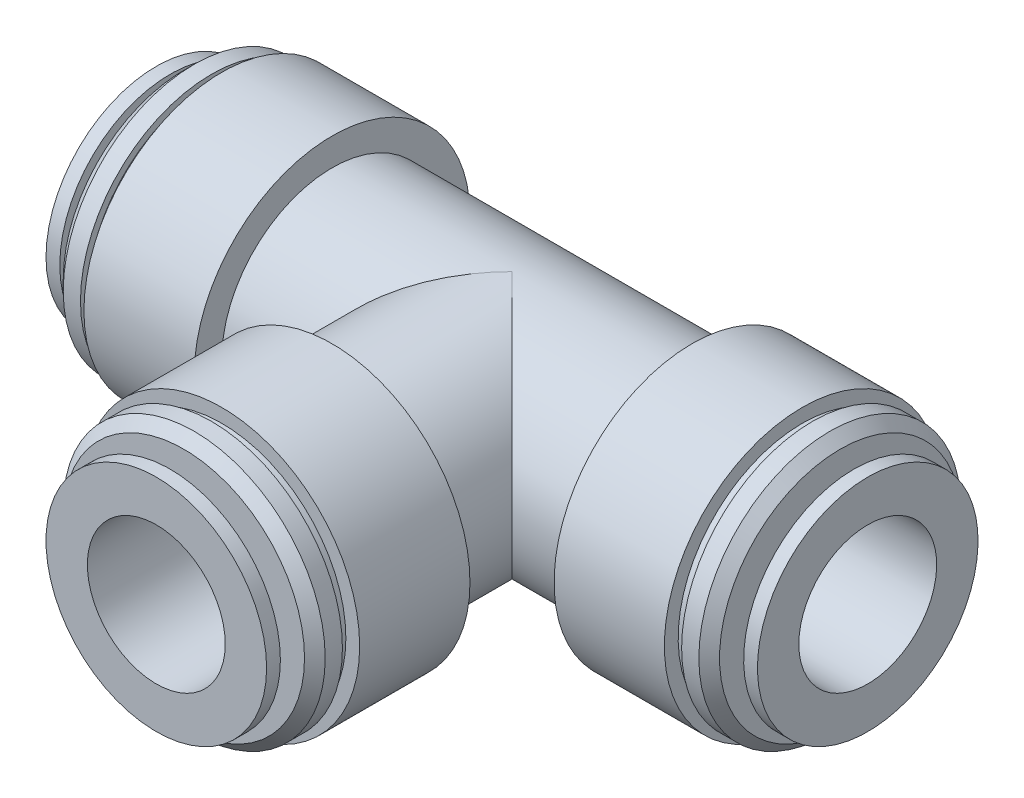
from build123d import *
from build123d.topology import SkipClean

# Parameters (mm, degrees)
SKETCH_2_R          = 8
SKETCH_2_R_2        = 4
EXTRUDE_1_DEPTH     = 26.1
SKETCH_4_R          = 8
EXTRUDE_2_DEPTH     = 13.05
SKETCH_6_R          = 5
CUT_EXTRUDE_1_DEPTH = 63.05
SKETCH_7_R          = 5
CUT_EXTRUDE_2_DEPTH = 25


with BuildPart() as part:
    # Эскиз1 → Повернуть1 (revolve)
    with BuildSketch(Plane.XY, mode=Mode.PRIVATE) as revolve_1_sk:
        Polygon((-16.75, -8), (-16.75, -6), (-15.75, -6), (-15.75, -8.75), (-15, -9.5), (-13.75, -9.5), (-13.75, -9), (-13, -9), (-13, -10), (-5, -10), (-5, -4), (-17.75, -4), (-17.75, -8), align=None)
    revolve(revolve_1_sk.sketch.rotate(Axis((-21.049489232, 0, 0), (1, 0, 0)), 270), axis=Axis((-21.049489232, 0, 0), (1, 0, 0)))

    # Эскиз2 → Бобышка-Вытянуть1 (add)
    with BuildSketch(Plane(origin=(-5, 0, 0), x_dir=(0, 0, -1), z_dir=(1, 0, 0))):
        with Locations(Location((0, 0, 0), (0, 0, 180))):
            Circle(SKETCH_2_R)
        with Locations(Location((0, 0, 0), (0, 0, 180))):
            Circle(SKETCH_2_R_2, mode=Mode.SUBTRACT)
    extrude(amount=EXTRUDE_1_DEPTH)

    # Эскиз3 → Повернуть2 (revolve)
    with SkipClean():  # the faces are left unmerged after this step: merging them gives an invalid solid
        with BuildSketch(Plane.XY):
            Polygon((32.85, 8), (32.85, 6), (31.85, 6), (31.85, 8.75), (31.1, 9.5), (29.85, 9.5), (29.85, 9), (29.1, 9), (29.1, 10), (21.1, 10), (21.1, 4), (33.85, 4), (33.85, 8), align=None)
        revolve(axis=Axis((47.149489232, 0, 0), (-1, 0, 0)))

    # Эскиз4 → Бобышка-Вытянуть2 (add)
    with SkipClean():  # the faces are left unmerged after this step: merging them gives an invalid solid
        with BuildSketch(Plane.XY):
            with Locations(Location((8.05, 0, 0), (0, 0, 90))):
                Circle(SKETCH_4_R)
        extrude(amount=EXTRUDE_2_DEPTH)

    # Эскиз5 → Повернуть3 (revolve)
    with SkipClean():  # the faces are left unmerged after this step: merging them gives an invalid solid
        with BuildSketch(Plane(origin=(0, 0, 0), x_dir=(1, 0, 0), z_dir=(0, 1, 0))):
            Polygon((16.05, -24.8), (14.05, -24.8), (14.05, -23.8), (16.8, -23.8), (17.55, -23.05), (17.55, -21.8), (17.05, -21.8), (17.05, -21.05), (18.05, -21.05), (18.05, -13.05), (12.05, -13.05), (12.05, -25.8), (16.05, -25.8), align=None)
        revolve(axis=Axis((8.05, 0, 29.099489232), (0, 0, -1)))

    # Эскиз6 → Вырез-Вытянуть1 (cut)
    with BuildSketch(Plane.ZY.offset(17.75)):
        Circle(SKETCH_6_R)
    extrude(amount=-CUT_EXTRUDE_1_DEPTH, mode=Mode.SUBTRACT)

    # Эскиз7 → Вырез-Вытянуть2 (cut)
    with BuildSketch(Plane.XY.offset(25.8)):
        with Locations((8.05, 0)):
            Circle(SKETCH_7_R)
    extrude(amount=-CUT_EXTRUDE_2_DEPTH, mode=Mode.SUBTRACT)


solid = part.part
